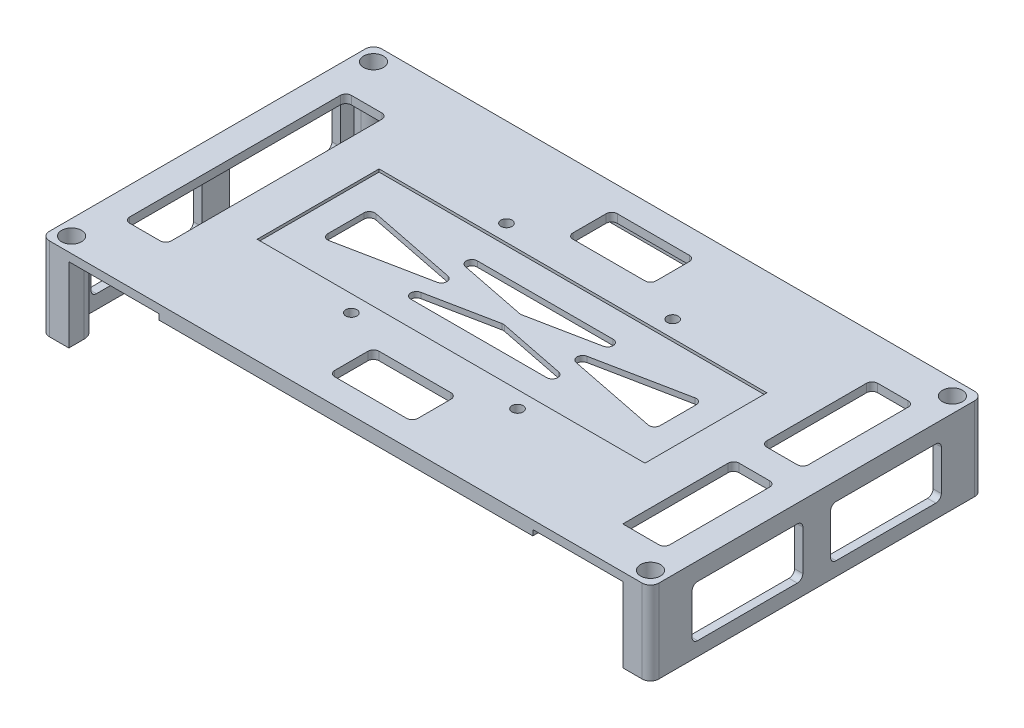
from build123d import *

# Parameters (mm, degrees)
SKETCH_8_W               = 220
SKETCH_8_H               = 120
EXTRUDE_6_DEPTH          = 3
SKETCH_10_W              = 10
SKETCH_10_H              = 120
EXTRUDE_7_DEPTH          = 27
CUT_EXTRUDE_1_DEPTH      = 129.175660716
CUT_EXTRUDE_1_DEPTH_BACK = 129.175660716
SKETCH_9_R               = 2.05
SKETCH_11_R              = 3.6
CUT_EXTRUDE_2_DEPTH      = 25
CUT_EXTRUDE_4_DEPTH      = 129.175660716
CUT_EXTRUDE_4_DEPTH_BACK = 129.175660716
SKETCH_13_W              = 40
SKETCH_13_H              = 18.5
SKETCH_14_W              = 140
SKETCH_14_H              = 44
CUT_EXTRUDE_7_DEPTH      = 1
SKETCH_15_W              = 15
SKETCH_15_H              = 80
SKETCH_15_H_2            = 40
SKETCH_15_W_2            = 30
SKETCH_15_H_3            = 16
CUT_EXTRUDE_8_DEPTH      = 129.840987267
SKETCH_9_5_R             = 2
CUT_EXTRUDE_9_DEPTH      = 129.175660716
CUT_EXTRUDE_13_DEPTH     = 27
SKETCH_20_W              = 135
SKETCH_20_H              = 8
EXTRUDE_8_DEPTH          = 2
FILLET_1_R               = 3
FILLET_2_R               = 2


with BuildPart() as part:
    # 草圖8 → 填料-伸長6 (new body)
    with BuildSketch(Plane(origin=(0, 0, 0), x_dir=(1, 0, 0), z_dir=(0, 1, 0))):
        Rectangle(SKETCH_8_W, SKETCH_8_H)
    extrude(amount=EXTRUDE_6_DEPTH)

    # 草圖10 → 填料-伸長7 (add)
    with BuildSketch(Plane.XZ):
        with Locations((-105, 0)):
            Rectangle(SKETCH_10_W, SKETCH_10_H)
        with Locations((105, 0)):
            Rectangle(SKETCH_10_W, SKETCH_10_H)
    extrude(amount=EXTRUDE_7_DEPTH)

    # 草圖9 → 除料-伸長1 (cut, two sides: drawn at the far end of the back side and taken through both)
    with BuildSketch(Plane(origin=(0, 0, 0), x_dir=(1, 0, 0), z_dir=(0, 1, 0)).offset(-CUT_EXTRUDE_1_DEPTH_BACK)):
        with Locations((104.5, 54.5)):
            Circle(SKETCH_9_R)
        with Locations((-104.5, 54.5)):
            Circle(SKETCH_9_R)
        with Locations((-104.5, -54.5)):
            Circle(SKETCH_9_R)
        with Locations((104.5, -54.5)):
            Circle(SKETCH_9_R)
    extrude(amount=CUT_EXTRUDE_1_DEPTH + CUT_EXTRUDE_1_DEPTH_BACK, mode=Mode.SUBTRACT)

    # 草圖11 → 除料-伸長2 (cut)
    with BuildSketch(Plane(origin=(0, 3, 0), x_dir=(1, 0, 0), z_dir=(0, 1, 0))):
        with Locations((-104.497380754, 54.5)):
            Circle(SKETCH_11_R)
        with Locations((-104.497380754, -54.5)):
            Circle(SKETCH_11_R)
        with Locations((104.5, -54.5)):
            Circle(SKETCH_11_R)
        with Locations((104.5, 54.5)):
            Circle(SKETCH_11_R)
    extrude(amount=-CUT_EXTRUDE_2_DEPTH, mode=Mode.SUBTRACT)

    # 草圖13 → 除料-伸長4 (cut, two sides: drawn at the far end of the back side and taken through both)
    with BuildSketch(Plane(origin=(0, 0, 0), x_dir=(0, 0, -1), z_dir=(1, 0, 0)).offset(-CUT_EXTRUDE_4_DEPTH_BACK)):
        with Locations((-25, -12.75)):
            Rectangle(SKETCH_13_W, SKETCH_13_H)
        with Locations((25, -12.75)):
            Rectangle(SKETCH_13_W, SKETCH_13_H)
    extrude(amount=CUT_EXTRUDE_4_DEPTH + CUT_EXTRUDE_4_DEPTH_BACK, mode=Mode.SUBTRACT)

    # 草圖14 → 除料-伸長7 (cut)
    with BuildSketch(Plane(origin=(0, 3, 0), x_dir=(1, 0, 0), z_dir=(0, 1, 0))):
        Rectangle(SKETCH_14_W, SKETCH_14_H)
    extrude(amount=-CUT_EXTRUDE_7_DEPTH, mode=Mode.SUBTRACT)

    # 草圖15 → 除料-伸長8 (cut, through all)
    with BuildSketch(Plane(origin=(0, 3, 0), x_dir=(1, 0, 0), z_dir=(0, 1, 0))):
        with Locations((-92.5, 0)):
            Rectangle(SKETCH_15_W, SKETCH_15_H)
        with Locations((92.5, 25)):
            Rectangle(SKETCH_15_W, SKETCH_15_H_2)
        Polygon((-44.702941459, -12), (44.702941459, -12), (0, -3.059411708), align=None)
        Polygon((-60, -8.940588292), (-60, 8.940588292), (-15.297058541, 0), align=None)
        Polygon((-44.702941459, 12), (44.702941459, 12), (0, 3.059411708), align=None)
        Polygon((60, -8.940588292), (60, 8.940588292), (15.297058541, 0), align=None)
        with Locations((0, -43)):
            Rectangle(SKETCH_15_W_2, SKETCH_15_H_3)
        with Locations((0, 43)):
            Rectangle(SKETCH_15_W_2, SKETCH_15_H_3)
        with Locations((92.5, -25)):
            Rectangle(SKETCH_15_W, SKETCH_15_H_2)
    extrude(amount=-CUT_EXTRUDE_8_DEPTH, mode=Mode.SUBTRACT)

    # 草圖9<5> → 除料-伸長9 (cut, through all)
    with BuildSketch(Plane(origin=(0, 0, 0), x_dir=(1, 0, 0), z_dir=(0, 1, 0))):
        with Locations((30, 28)):
            Circle(SKETCH_9_5_R)
        with Locations((-30, 28)):
            Circle(SKETCH_9_5_R)
        with Locations((30, -28)):
            Circle(SKETCH_9_5_R)
        with Locations((-30, -28)):
            Circle(SKETCH_9_5_R)
    extrude(amount=CUT_EXTRUDE_9_DEPTH, mode=Mode.SUBTRACT)

    # 草圖19 → 除料-伸長13 (cut)
    with BuildSketch(Plane.XZ.offset(27)):
        with BuildLine():
            Line((-100, 54.5), (-100, -54.5))
            ThreePointArc((-100, -54.5), (-101.318019485, -51.318019485), (-104.5, -50))
            Line((-104.5, -50), (-107, -50))
            Line((-107, -50), (-107, 50))
            Line((-107, 50), (-104.5, 50))
            ThreePointArc((-104.5, 50), (-101.318019485, 51.318019485), (-100, 54.5))
        make_face()
        with BuildLine():
            Line((100, 54.5), (100, -54.5))
            ThreePointArc((100, -54.5), (101.318019485, -51.318019485), (104.5, -50))
            Line((104.5, -50), (107, -50))
            Line((107, -50), (107, 50))
            Line((107, 50), (104.5, 50))
            ThreePointArc((104.5, 50), (101.318019485, 51.318019485), (100, 54.5))
        make_face()
    extrude(amount=-CUT_EXTRUDE_13_DEPTH, mode=Mode.SUBTRACT)

    # 草圖20 → 填料-伸長8 (add)
    with BuildSketch(Plane.XZ):
        with Locations((0, 56)):
            Rectangle(SKETCH_20_W, SKETCH_20_H)
        with Locations((0, -56)):
            Rectangle(SKETCH_20_W, SKETCH_20_H)
        Polygon((-59, 32.5), (-39, 32.5), (-39, 29.5), (-54, 29.5), (-54, 25), (-59, 25), align=None)
        Polygon((54, 29.5), (39, 29.5), (39, 32.5), (59, 32.5), (59, 25), (54, 25), align=None)
        Polygon((59, -32.5), (39, -32.5), (39, -29.5), (54, -29.5), (54, -25), (59, -25), align=None)
        Polygon((-54, -29.5), (-39, -29.5), (-39, -32.5), (-59, -32.5), (-59, -25), (-54, -25), align=None)
    extrude(amount=EXTRUDE_8_DEPTH)

    # 圓角1
    fillet_1_edges = [part.edges().sort_by_distance(p)[0] for p in [
        (-110, -12, 60),
        (-110, -12, -60),
        (110, -12, -60),
        (110, -12, 60),
    ]]
    fillet(fillet_1_edges, radius=FILLET_1_R)

    # 圓角2
    fillet_2_edges = [part.edges().sort_by_distance(p)[0] for p in [
        (-107, 0, 0),
        (107, 0, 0),
        (108.5, -3.5, -5),
        (108.5, -3.5, 45),
        (108.5, -22, 45),
        (108.5, -22, -5),
        (108.5, -3.5, -45),
        (108.5, -3.5, 5),
        (108.5, -22, 5),
        (108.5, -22, -45),
        (-108.5, -22, -45),
        (-108.5, -22, 5),
        (-108.5, -3.5, -45),
        (-108.5, -3.5, 5),
        (-108.5, -22, 45),
        (-108.5, -3.5, 45),
        (-108.5, -3.5, -5),
        (-108.5, -22, -5),
        (60, 1, -8.940588292),
        (44.702941459, 1, -12),
        (-44.702941459, 1, -12),
        (0, 1, 3.059411708),
        (-44.702941459, 1, 12),
        (44.702941459, 1, 12),
        (-15.297058541, 1, 0),
        (0, 1, -3.059411708),
        (60, 1, 8.940588292),
        (100, 1.5, -5),
        (15, 1.5, -35),
        (100, 1.5, 45),
        (15, 1.5, 51),
        (-85, 1.5, 40),
        (-15, 1.5, 51),
        (85, 1.5, -5),
        (15.297058541, 1, 0),
        (-100, 1.5, 40),
        (-15, 1.5, -35),
        (-60, 1, 8.940588292),
        (-60, 1, -8.940588292),
        (15, 1.5, 35),
        (-15, 1.5, 35),
        (85, 1.5, 5),
        (85, 1.5, -45),
        (100, 1.5, 5),
        (100, 1.5, -45),
        (15, 1.5, -51),
        (-15, 1.5, -51),
        (-85, 1.5, -40),
        (-100, 1.5, -40),
    ]]
    fillet(fillet_2_edges, radius=FILLET_2_R)


solid = part.part
